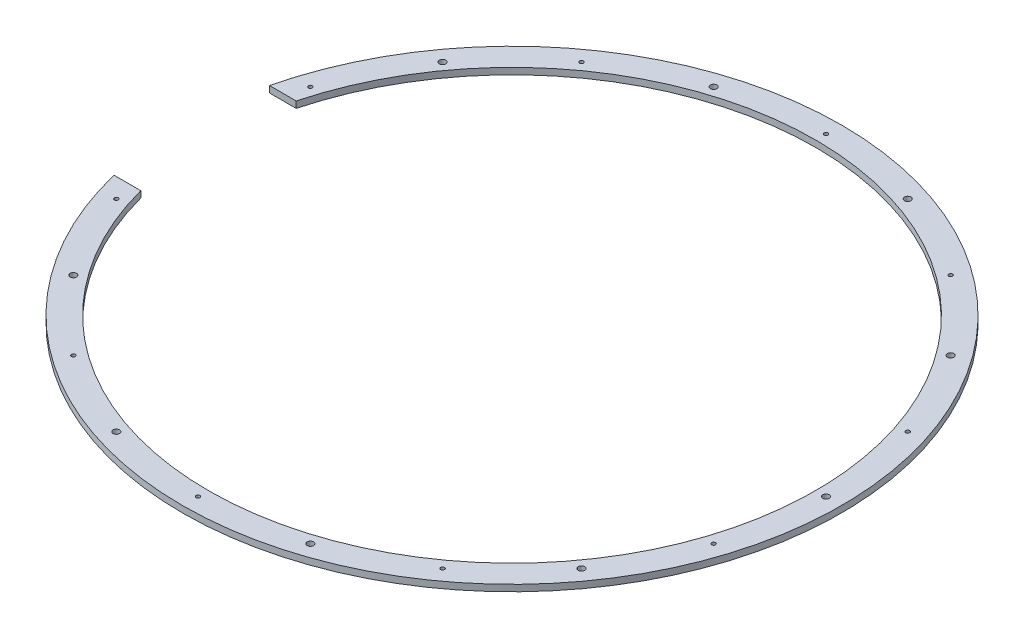
from build123d import *

# Parameters (mm, degrees)
SKETCH1_R           = 254.5
SKETCH1_R_2         = 234.5
BOSS_EXTRUDE1_DEPTH = 5
SKETCH2_W           = 27.805822748
SKETCH2_H           = 60
CUT_EXTRUDE1_DEPTH  = 5
SKETCH3_R           = 2.5
CUT_EXTRUDE2_DEPTH  = 5
SKETCH4_R           = 1.5
CUT_EXTRUDE3_DEPTH  = 5


with BuildPart() as part:
    # Sketch1 → Boss-Extrude1 (new body)
    with BuildSketch(Plane(origin=(0, 0, 0), x_dir=(1, 0, 0), z_dir=(0, 1, 0))):
        with Locations(Location((0, 0, 0), (0, 0, 270))):
            Circle(SKETCH1_R)
        with Locations(Location((0, 0, 0), (0, 0, 270))):
            Circle(SKETCH1_R_2, mode=Mode.SUBTRACT)
    extrude(amount=BOSS_EXTRUDE1_DEPTH)

    # Sketch2 → Cut-Extrude1 (cut)
    with BuildSketch(Plane(origin=(0, 5, 0), x_dir=(1, 0, 0), z_dir=(0, 1, 0))):
        with Locations((-240.597088626, 30)):
            Rectangle(SKETCH2_W, SKETCH2_H)
    cut_extrude1 = extrude(amount=-CUT_EXTRUDE1_DEPTH, mode=Mode.SUBTRACT)

    # Mirror1: Cut-Extrude1 across plane
    add(cut_extrude1.mirror(Plane.XY), mode=Mode.SUBTRACT)

    # Sketch3 → Cut-Extrude2 (cut)
    with BuildSketch(Plane(origin=(0, 5, 0), x_dir=(1, 0, 0), z_dir=(0, 1, 0))):
        with Locations(Location((242.5, 0, 0), (0, 0, 270))):
            Circle(SKETCH3_R)
        with Locations(Location((196.186621136, -142.537923681, 0), (0, 0, 270))):
            Circle(SKETCH3_R)
        with Locations(Location((74.936621136, -230.631205202, 0), (0, 0, 270))):
            Circle(SKETCH3_R)
        with Locations(Location((-74.936621136, -230.631205202, 0), (0, 0, 270))):
            Circle(SKETCH3_R)
        with Locations(Location((-196.186621136, -142.537923681, 0), (0, 0, 270))):
            Circle(SKETCH3_R)
        with Locations((-242.5, 0)):
            Circle(SKETCH3_R)
        with Locations(Location((-196.186621136, 142.537923681, 0), (0, 0, 270))):
            Circle(SKETCH3_R)
        with Locations(Location((-74.936621136, 230.631205202, 0), (0, 0, 270))):
            Circle(SKETCH3_R)
        with Locations(Location((74.936621136, 230.631205202, 0), (0, 0, 270))):
            Circle(SKETCH3_R)
        with Locations(Location((196.186621136, 142.537923681, 0), (0, 0, 270))):
            Circle(SKETCH3_R)
    extrude(amount=-CUT_EXTRUDE2_DEPTH, mode=Mode.SUBTRACT)

    # Sketch4 → Cut-Extrude3 (cut)
    with BuildSketch(Plane(origin=(0, 5, 0), x_dir=(1, 0, 0), z_dir=(0, 1, 0))):
        with Locations(Location((0, -242.5, 0), (0, 0, 270))):
            Circle(SKETCH4_R)
        with Locations(Location((-142.537923681, -196.186621136, 0), (0, 0, 270))):
            Circle(SKETCH4_R)
        with Locations(Location((-230.631205202, -74.936621136, 0), (0, 0, 270))):
            Circle(SKETCH4_R)
        with Locations(Location((-230.631205202, 74.936621136, 0), (0, 0, 270))):
            Circle(SKETCH4_R)
        with Locations(Location((-142.537923681, 196.186621136, 0), (0, 0, 270))):
            Circle(SKETCH4_R)
        with Locations(Location((0, 242.5, 0), (0, 0, 270))):
            Circle(SKETCH4_R)
        with Locations(Location((142.537923681, 196.186621136, 0), (0, 0, 270))):
            Circle(SKETCH4_R)
        with Locations(Location((230.631205202, 74.936621136, 0), (0, 0, 270))):
            Circle(SKETCH4_R)
        with Locations(Location((230.631205202, -74.936621136, 0), (0, 0, 270))):
            Circle(SKETCH4_R)
        with Locations(Location((142.537923681, -196.186621136, 0), (0, 0, 270))):
            Circle(SKETCH4_R)
    extrude(amount=-CUT_EXTRUDE3_DEPTH, mode=Mode.SUBTRACT)


solid = part.part
